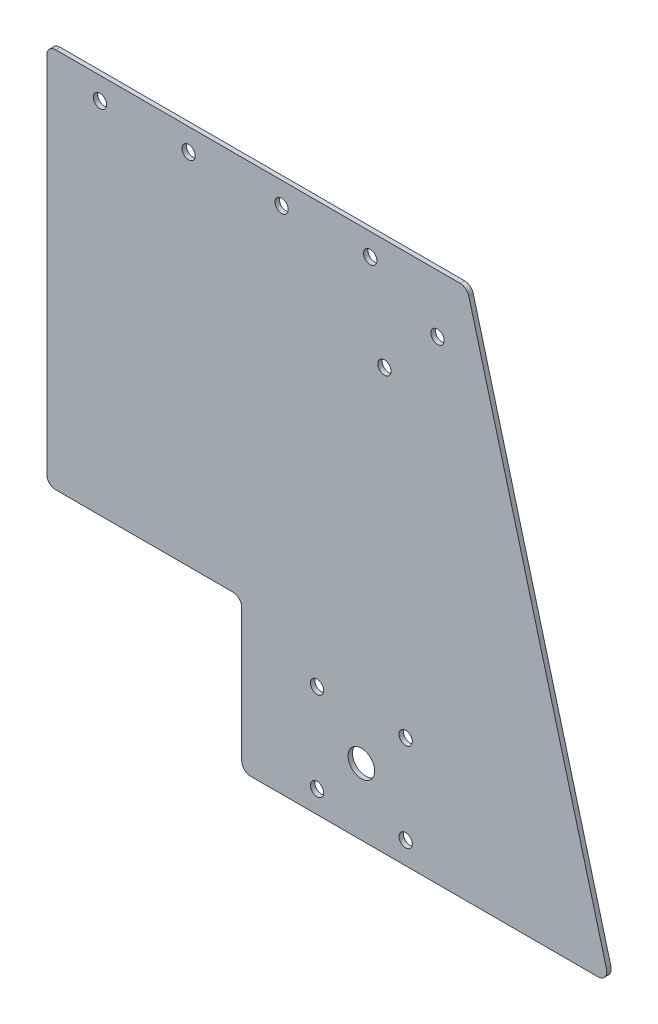
from build123d import *

# Parameters (mm, degrees)
SKETCH_1_R           = 1.5
SKETCH_1_R_2         = 3
EXTRUDE_1_DEPTH      = 1
SKETCH_4_R           = 1.5
CUT_EXTRUDE_2_DEPTH  = 4
SKETCH_5_R           = 1.5
CUT_EXTRUDE_3_DEPTH  = 10
SKETCH_6_W           = 53
SKETCH_6_H           = 34
CUT_EXTRUDE_4_DEPTH  = 10
SKETCH_7_W           = 39
SKETCH_7_H           = 34
CUT_EXTRUDE_5_DEPTH  = 10
SKETCH_10_R          = 10
CUT_EXTRUDE_8_DEPTH  = 10
SKETCH_13_R          = 1.5
CUT_EXTRUDE_10_DEPTH = 1
FILLET_1_R           = 2
EXTRUDE_START        = -1
SKETCH_20_R          = 10
EXTRUDE_3_DEPTH      = 1
SKETCH_21_W          = 48
SKETCH_21_H          = 86
CUT_EXTRUDE_16_DEPTH = 10
FILLET_5_R           = 2


with BuildPart() as part:
    # 草图1 → 凸台-拉伸1 (new body)
    with BuildSketch(Plane.XY):
        Polygon((0, 0), (175, 0), (142.846096908, 120), (0, 120), align=None)
        with Locations((129, 25)):
            Circle(SKETCH_1_R, mode=Mode.SUBTRACT)
        with Locations((129, 5)):
            Circle(SKETCH_1_R, mode=Mode.SUBTRACT)
        with Locations((119, 15)):
            Circle(SKETCH_1_R_2, mode=Mode.SUBTRACT)
        with Locations((109, 5)):
            Circle(SKETCH_1_R, mode=Mode.SUBTRACT)
        with Locations((109, 25)):
            Circle(SKETCH_1_R, mode=Mode.SUBTRACT)
    extrude(amount=EXTRUDE_1_DEPTH)

    # 草图4 → 切除-拉伸2 (cut)
    with BuildSketch(Plane(origin=(0, 0, 0), x_dir=(-1, 0, 0), z_dir=(0, 0, -1))):
        with Locations((-22, 101)):
            Circle(SKETCH_4_R)
        with Locations((-22, 81)):
            Circle(SKETCH_4_R)
        with Locations((-22, 60)):
            Circle(SKETCH_4_R)
        with Locations((-22, 40)):
            Circle(SKETCH_4_R)
    extrude(amount=-CUT_EXTRUDE_2_DEPTH, mode=Mode.SUBTRACT)

    # 草图5 → 切除-拉伸3 (cut)
    with BuildSketch(Plane(origin=(0, 0, 0), x_dir=(-1, 0, 0), z_dir=(0, 0, -1))):
        with Locations((-136.2, 107)):
            Circle(SKETCH_5_R)
        with Locations((-124.2, 95)):
            Circle(SKETCH_5_R)
    extrude(amount=-CUT_EXTRUDE_3_DEPTH, mode=Mode.SUBTRACT)

    # 草图6 → 切除-拉伸4 (cut)
    with BuildSketch(Plane.XY.offset(1)):
        with Locations((26.5, 17)):
            Rectangle(SKETCH_6_W, SKETCH_6_H)
    extrude(amount=-CUT_EXTRUDE_4_DEPTH, mode=Mode.SUBTRACT)

    # 草图7 → 切除-拉伸5 (cut)
    with BuildSketch(Plane.XY.offset(1)):
        with Locations((72.5, 17)):
            Rectangle(SKETCH_7_W, SKETCH_7_H)
    extrude(amount=-CUT_EXTRUDE_5_DEPTH, mode=Mode.SUBTRACT)

    # 草图10 → 切除-拉伸8 (cut)
    with BuildSketch(Plane.XY.offset(1)):
        with Locations((37, 104)):
            Circle(SKETCH_10_R)
    extrude(amount=-CUT_EXTRUDE_8_DEPTH, mode=Mode.SUBTRACT)

    # 草图13 → 切除-拉伸10 (cut)
    with BuildSketch(Plane.XY.offset(1)):
        with Locations((121, 115)):
            Circle(SKETCH_13_R)
        with Locations((101, 115)):
            Circle(SKETCH_13_R)
        with Locations((80, 115)):
            Circle(SKETCH_13_R)
        with Locations((60, 115)):
            Circle(SKETCH_13_R)
        with Locations((45, 115)):
            Circle(SKETCH_13_R)
        with Locations((25, 115)):
            Circle(SKETCH_13_R)
    extrude(amount=-CUT_EXTRUDE_10_DEPTH, mode=Mode.SUBTRACT)

    # 圆角1
    fillet_1_edges = [part.edges().sort_by_distance(p)[0] for p in [
        (0, 34, 0.5),
        (0, 120, 0.5),
        (142.846096908, 120, 0.5),
        (175, 0, 0.5),
        (92, 34, 0.5),
        (92, 0, 0.5),
    ]]
    fillet(fillet_1_edges, radius=FILLET_1_R)

    # 草图20 → 凸台-拉伸3 (add)
    with BuildSketch(Plane(origin=(0, 0, 0), x_dir=(-1, 0, 0), z_dir=(0, 0, -1)).offset(EXTRUDE_START)):
        with Locations((-37, 104)):
            Circle(SKETCH_20_R)
    extrude(amount=EXTRUDE_3_DEPTH)

    # 草图21 → 切除-拉伸16 (cut)
    with BuildSketch(Plane(origin=(0, 0, 0), x_dir=(-1, 0, 0), z_dir=(0, 0, -1))):
        with Locations((-24, 77)):
            Rectangle(SKETCH_21_W, SKETCH_21_H)
    extrude(amount=-CUT_EXTRUDE_16_DEPTH, mode=Mode.SUBTRACT)

    # 圆角5
    fillet_5_edges = [part.edges().sort_by_distance(p)[0] for p in [
        (48, 34, 0.5),
        (48, 120, 0.5),
    ]]
    fillet(fillet_5_edges, radius=FILLET_5_R)


solid = part.part
